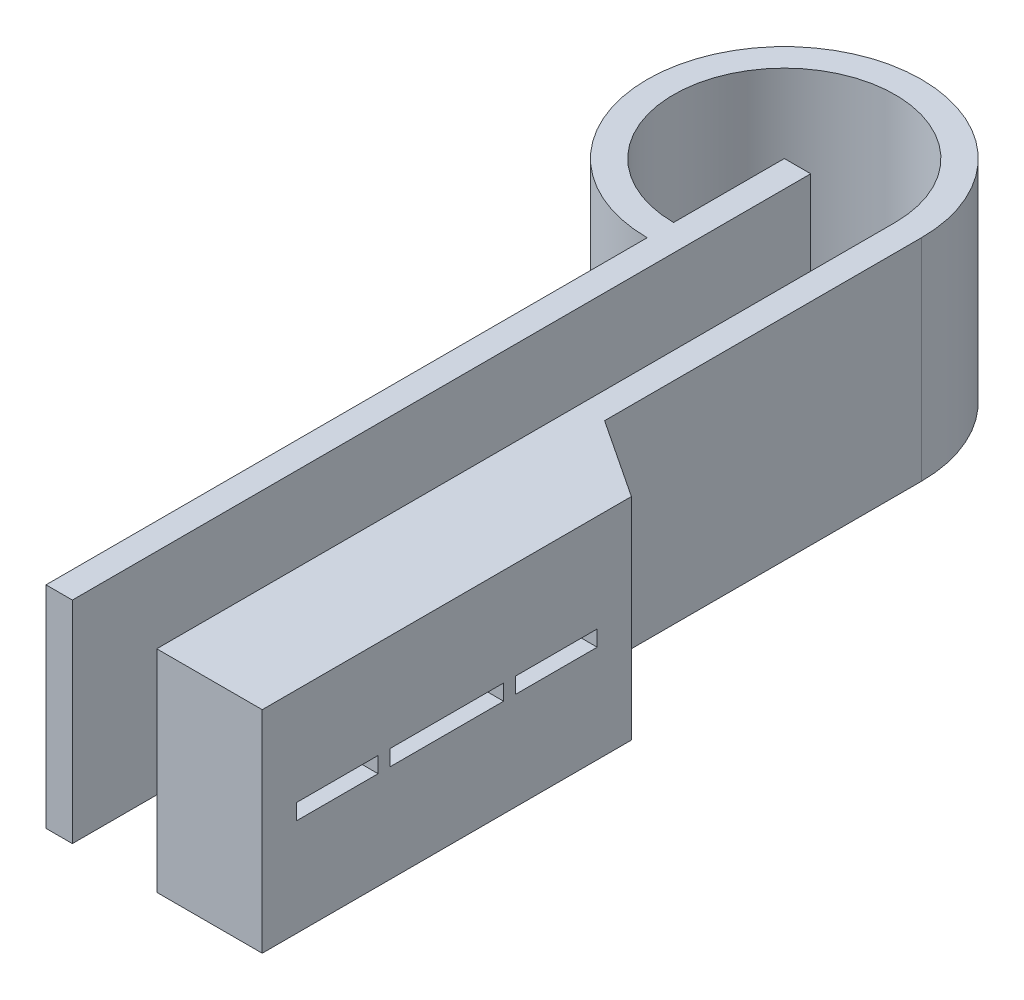
from build123d import *

# Parameters (mm, degrees)
BOSS_EXTRUDE1_DEPTH = 20
SKETCH2_R           = 4
CUT_EXTRUDE2_DEPTH  = 8
SKETCH3_W           = 7.740011002
SKETCH3_H           = 1.5
SKETCH3_W_2         = 10.772479775
CUT_EXTRUDE4_DEPTH  = 10
SKETCH4_W           = 10
SKETCH4_H           = 15
CUT_EXTRUDE5_DEPTH  = 2


with BuildPart() as part:
    # Sketch1 → Boss-Extrude1 (new body)
    with BuildSketch(Plane(origin=(0, 0, 0), x_dir=(1, 0, 0), z_dir=(0, 1, 0))):
        with BuildLine():
            Line((-30.801242739, -7.293137555), (-30.801242739, 22.748893216))
            ThreePointArc((-30.801242739, 22.748893216), (-52.993630348, 31.941283464), (-43.801242739, 9.748894762))
            Line((-43.801242739, 9.748894762), (-43.801242739, -47.251105238))
            Line((-43.801242739, -47.251105238), (-41.301242739, -47.251105238))
            Line((-41.301242739, -47.251105238), (-41.301242739, 22.748894762))
            Line((-41.301242739, 22.748894762), (-43.801242739, 22.748894762))
            Line((-43.801242739, 22.748894762), (-43.801242739, 12.248894762))
            ThreePointArc((-43.801242739, 12.248894762), (-51.225863395, 30.173516511), (-33.301242739, 22.748893216))
            Line((-33.301242739, 22.748893216), (-33.301242739, -47.251106784))
            Line((-33.301242739, -47.251106784), (-23.301242739, -47.251106784))
            Line((-23.301242739, -47.251106784), (-23.301242739, -12.251106784))
            Line((-23.301242739, -12.251106784), (-30.801242739, -7.293137555))
        make_face()
    extrude(amount=BOSS_EXTRUDE1_DEPTH)

    # Sketch2 → Cut-Extrude2 (cut)
    with BuildSketch(Plane.ZY.offset(33.301242739)):
        with Locations((19.751105238, 10)):
            Circle(SKETCH2_R)
        with Locations((39.751105238, 10)):
            Circle(SKETCH2_R)
    extrude(amount=-CUT_EXTRUDE2_DEPTH, mode=Mode.SUBTRACT)

    # Sketch3 → Cut-Extrude4 (cut)
    with BuildSketch(Plane(origin=(-23.301242739, 0, 0), x_dir=(0, 0, -1), z_dir=(1, 0, 0))):
        with Locations((-40.137346671, 10)):
            Rectangle(SKETCH3_W, SKETCH3_H)
        with Locations((-29.751106784, 10)):
            Rectangle(SKETCH3_W_2, SKETCH3_H)
        with Locations((-19.364866896, 10)):
            Rectangle(SKETCH3_W, SKETCH3_H)
    extrude(amount=-CUT_EXTRUDE4_DEPTH, mode=Mode.SUBTRACT)

    # Sketch4 → Cut-Extrude5 (cut)
    with BuildSketch(Plane.ZY.offset(33.301242739)):
        with Locations((29.751105238, 10)):
            Rectangle(SKETCH4_W, SKETCH4_H)
    extrude(amount=-CUT_EXTRUDE5_DEPTH, mode=Mode.SUBTRACT)


solid = part.part
